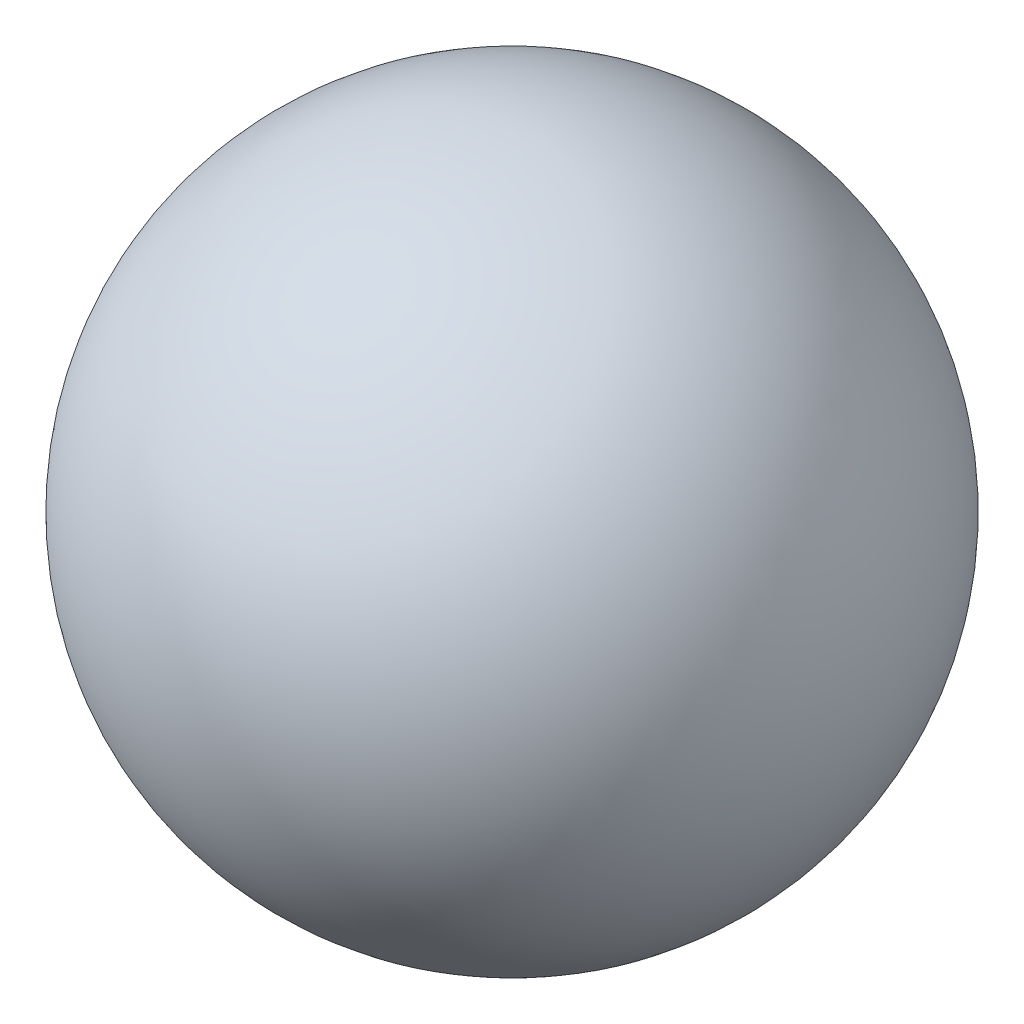
from build123d import *


with BuildPart() as part:
    # Sketch2 → Revolve1 (revolve)
    with BuildSketch(Plane.XY):
        with BuildLine():
            Line((0, 101.6), (0, -101.6))
            ThreePointArc((0, -101.6), (101.6, 0), (0, 101.6))
        make_face()
    revolve(axis=Axis((0, 101.6, 0), (0, -1, 0)))


solid = part.part
